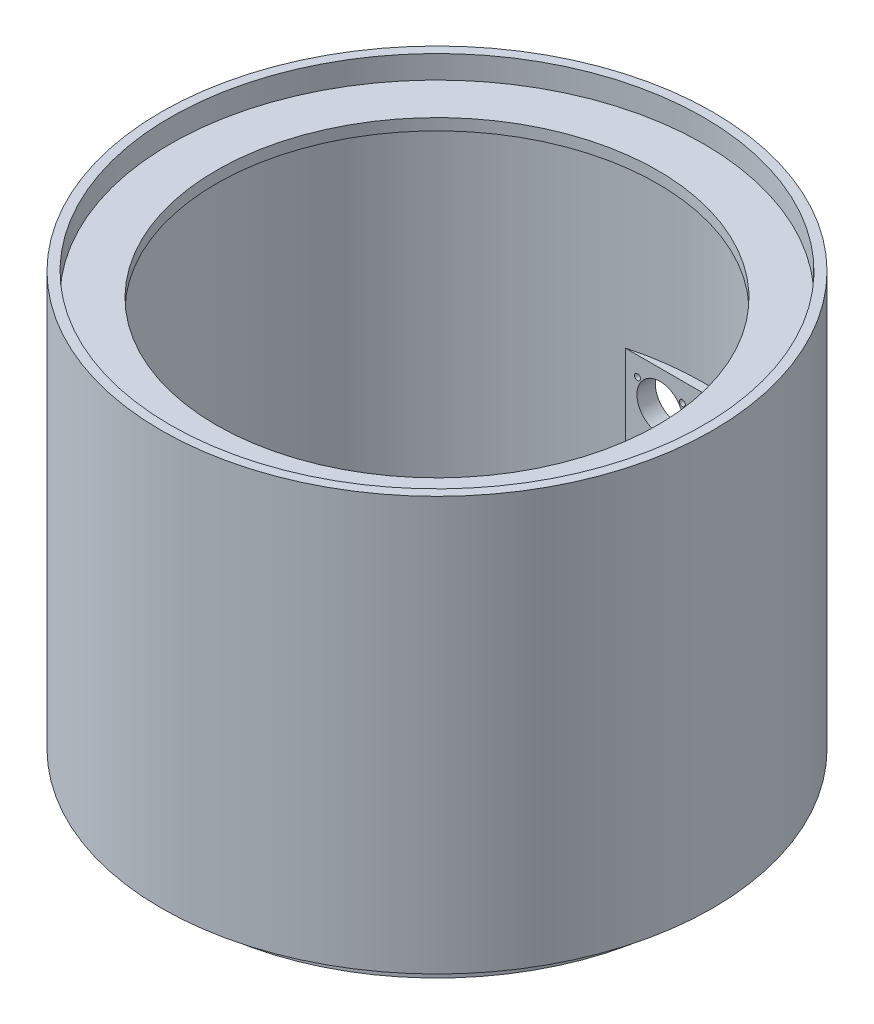
from build123d import *

# Parameters (mm, degrees)
CUT_EXTRUDE_1_REACH      = 256.755
SKETCH_2_R               = 2.5
PATTERN_CIRCULAR_1_COUNT = 12
SKETCH_3_W               = 60
SKETCH_3_H               = 45
EXTRUDE_1_DEPTH          = 8
CUT_EXTRUDE_2_REACH      = 330.786
SKETCH_4_R               = 10
SKETCH_4_R_2             = 1.3
CUT_EXTRUDE_3_REACH      = 330.786
SKETCH_5_R               = 1.3
SKETCH_5_W               = 12
SKETCH_5_H               = 22


with BuildPart() as part:
    # 草圖1 → 旋轉1 (revolve)
    with BuildSketch(Plane(origin=(0, 0, 0), x_dir=(0, 0, -1), z_dir=(1, 0, 0))):
        Polygon((0, 0), (108, 0), (108, 10), (120, 10), (120, 190), (116, 190), (116, 180), (96, 180), (96, 175), (116, 175), (116, 15), (104, 15), (104, 5), (0, 5), align=None)
    revolve(axis=Axis((0, 5, 0), (0, -1, 0)))

    # 草圖2 → 除料-伸長1 (cut, up to next)
    with BuildSketch(Plane.XZ, mode=Mode.PRIVATE) as cut_extrude_1_sk1:
        with Locations((0, -15)):
            Circle(SKETCH_2_R)
    cut_extrude_1_tool1 = extrude(cut_extrude_1_sk1.sketch, amount=-CUT_EXTRUDE_1_REACH, mode=Mode.PRIVATE) & part.part
    # 草圖2 → 除料-伸長1 (cut, up to next)
    with BuildSketch(Plane.XZ, mode=Mode.PRIVATE) as cut_extrude_1_sk2:
        with Locations((0, -25)):
            Circle(SKETCH_2_R)
    cut_extrude_1_tool2 = extrude(cut_extrude_1_sk2.sketch, amount=-CUT_EXTRUDE_1_REACH, mode=Mode.PRIVATE) & part.part
    # 草圖2 → 除料-伸長1 (cut, up to next)
    with BuildSketch(Plane.XZ, mode=Mode.PRIVATE) as cut_extrude_1_sk3:
        with Locations((0, -35)):
            Circle(SKETCH_2_R)
    cut_extrude_1_tool3 = extrude(cut_extrude_1_sk3.sketch, amount=-CUT_EXTRUDE_1_REACH, mode=Mode.PRIVATE) & part.part
    # 草圖2 → 除料-伸長1 (cut, up to next)
    with BuildSketch(Plane.XZ, mode=Mode.PRIVATE) as cut_extrude_1_sk4:
        with Locations((0, -45)):
            Circle(SKETCH_2_R)
    cut_extrude_1_tool4 = extrude(cut_extrude_1_sk4.sketch, amount=-CUT_EXTRUDE_1_REACH, mode=Mode.PRIVATE) & part.part
    # 草圖2 → 除料-伸長1 (cut, up to next)
    with BuildSketch(Plane.XZ, mode=Mode.PRIVATE) as cut_extrude_1_sk5:
        with Locations((0, -55)):
            Circle(SKETCH_2_R)
    cut_extrude_1_tool5 = extrude(cut_extrude_1_sk5.sketch, amount=-CUT_EXTRUDE_1_REACH, mode=Mode.PRIVATE) & part.part
    # 草圖2 → 除料-伸長1 (cut, up to next)
    with BuildSketch(Plane.XZ, mode=Mode.PRIVATE) as cut_extrude_1_sk6:
        with Locations((0, -65)):
            Circle(SKETCH_2_R)
    cut_extrude_1_tool6 = extrude(cut_extrude_1_sk6.sketch, amount=-CUT_EXTRUDE_1_REACH, mode=Mode.PRIVATE) & part.part
    # 草圖2 → 除料-伸長1 (cut, up to next)
    with BuildSketch(Plane.XZ, mode=Mode.PRIVATE) as cut_extrude_1_sk7:
        with Locations((0, -75)):
            Circle(SKETCH_2_R)
    cut_extrude_1_tool7 = extrude(cut_extrude_1_sk7.sketch, amount=-CUT_EXTRUDE_1_REACH, mode=Mode.PRIVATE) & part.part
    cut_extrude_1_1 = cut_extrude_1_tool1.solids().sort_by_distance((0, 0, -15))[0]
    add(cut_extrude_1_1, mode=Mode.SUBTRACT)
    cut_extrude_1_2 = cut_extrude_1_tool2.solids().sort_by_distance((0, 0, -25))[0]
    add(cut_extrude_1_2, mode=Mode.SUBTRACT)
    cut_extrude_1_3 = cut_extrude_1_tool3.solids().sort_by_distance((0, 0, -35))[0]
    add(cut_extrude_1_3, mode=Mode.SUBTRACT)
    cut_extrude_1_4 = cut_extrude_1_tool4.solids().sort_by_distance((0, 0, -45))[0]
    add(cut_extrude_1_4, mode=Mode.SUBTRACT)
    cut_extrude_1_5 = cut_extrude_1_tool5.solids().sort_by_distance((0, 0, -55))[0]
    add(cut_extrude_1_5, mode=Mode.SUBTRACT)
    cut_extrude_1_6 = cut_extrude_1_tool6.solids().sort_by_distance((0, 0, -65))[0]
    add(cut_extrude_1_6, mode=Mode.SUBTRACT)
    cut_extrude_1_7 = cut_extrude_1_tool7.solids().sort_by_distance((0, 0, -75))[0]
    add(cut_extrude_1_7, mode=Mode.SUBTRACT)
    cut_extrude_1 = cut_extrude_1_1 + cut_extrude_1_2 + cut_extrude_1_3 + cut_extrude_1_4 + cut_extrude_1_5 + cut_extrude_1_6 + cut_extrude_1_7  # 除料-伸長1 as one shape, for the pattern or mirror that repeats it

    # 環狀複製排列1: 除料-伸長1 ×12 about axis
    pattern_circular_1_axis = Axis((0, 15, 0), (0, 1, 0))
    for i in range(1, PATTERN_CIRCULAR_1_COUNT):
        add(cut_extrude_1.rotate(pattern_circular_1_axis, i * 360 / PATTERN_CIRCULAR_1_COUNT), mode=Mode.SUBTRACT)

    # 草圖3 → 填料-伸長1 (add)
    with BuildSketch(Plane(origin=(0, 0, -120), x_dir=(-1, 0, 0), z_dir=(0, 0, -1))):
        with Locations((0, 67.5)):
            Rectangle(SKETCH_3_W, SKETCH_3_H)
    extrude(amount=-EXTRUDE_1_DEPTH)

    # 草圖4 → 除料-伸長2 (cut, up to next)
    with BuildSketch(Plane(origin=(0, 0, -120), x_dir=(-1, 0, 0), z_dir=(0, 0, -1)), mode=Mode.PRIVATE) as cut_extrude_2_sk1:
        with Locations((15, 75)):
            Circle(SKETCH_4_R)
    cut_extrude_2_tool1 = extrude(cut_extrude_2_sk1.sketch, amount=-CUT_EXTRUDE_2_REACH, mode=Mode.PRIVATE) & part.part
    # 草圖4 → 除料-伸長2 (cut, up to next)
    with BuildSketch(Plane(origin=(0, 0, -120), x_dir=(-1, 0, 0), z_dir=(0, 0, -1)), mode=Mode.PRIVATE) as cut_extrude_2_sk2:
        with Locations((24.75, 81.7)):
            Circle(SKETCH_4_R_2)
    cut_extrude_2_tool2 = extrude(cut_extrude_2_sk2.sketch, amount=-CUT_EXTRUDE_2_REACH, mode=Mode.PRIVATE) & part.part
    # 草圖4 → 除料-伸長2 (cut, up to next)
    with BuildSketch(Plane(origin=(0, 0, -120), x_dir=(-1, 0, 0), z_dir=(0, 0, -1)), mode=Mode.PRIVATE) as cut_extrude_2_sk3:
        with Locations((5.25, 81.7)):
            Circle(SKETCH_4_R_2)
    cut_extrude_2_tool3 = extrude(cut_extrude_2_sk3.sketch, amount=-CUT_EXTRUDE_2_REACH, mode=Mode.PRIVATE) & part.part
    # 草圖4 → 除料-伸長2 (cut, up to next)
    with BuildSketch(Plane(origin=(0, 0, -120), x_dir=(-1, 0, 0), z_dir=(0, 0, -1)), mode=Mode.PRIVATE) as cut_extrude_2_sk4:
        with Locations((5.25, 47.7)):
            Circle(SKETCH_4_R_2)
    cut_extrude_2_tool4 = extrude(cut_extrude_2_sk4.sketch, amount=-CUT_EXTRUDE_2_REACH, mode=Mode.PRIVATE) & part.part
    # 草圖4 → 除料-伸長2 (cut, up to next)
    with BuildSketch(Plane(origin=(0, 0, -120), x_dir=(-1, 0, 0), z_dir=(0, 0, -1)), mode=Mode.PRIVATE) as cut_extrude_2_sk5:
        with Locations((24.75, 47.7)):
            Circle(SKETCH_4_R_2)
    cut_extrude_2_tool5 = extrude(cut_extrude_2_sk5.sketch, amount=-CUT_EXTRUDE_2_REACH, mode=Mode.PRIVATE) & part.part
    add(cut_extrude_2_tool1.solids().sort_by_distance((-15, 75, -120))[0], mode=Mode.SUBTRACT)
    add(cut_extrude_2_tool2.solids().sort_by_distance((-24.75, 81.7, -120))[0], mode=Mode.SUBTRACT)
    add(cut_extrude_2_tool3.solids().sort_by_distance((-5.25, 81.7, -120))[0], mode=Mode.SUBTRACT)
    add(cut_extrude_2_tool4.solids().sort_by_distance((-5.25, 47.7, -120))[0], mode=Mode.SUBTRACT)
    add(cut_extrude_2_tool5.solids().sort_by_distance((-24.75, 47.7, -120))[0], mode=Mode.SUBTRACT)

    # 草圖5 → 除料-伸長3 (cut, up to next)
    with BuildSketch(Plane(origin=(0, 0, -120), x_dir=(-1, 0, 0), z_dir=(0, 0, -1)), mode=Mode.PRIVATE) as cut_extrude_3_sk1:
        with Locations((-19, 87)):
            Circle(SKETCH_5_R)
    cut_extrude_3_tool1 = extrude(cut_extrude_3_sk1.sketch, amount=-CUT_EXTRUDE_3_REACH, mode=Mode.PRIVATE) & part.part
    # 草圖5 → 除料-伸長3 (cut, up to next)
    with BuildSketch(Plane(origin=(0, 0, -120), x_dir=(-1, 0, 0), z_dir=(0, 0, -1)), mode=Mode.PRIVATE) as cut_extrude_3_sk2:
        with Locations((-19, 60.5)):
            Circle(SKETCH_5_R)
    cut_extrude_3_tool2 = extrude(cut_extrude_3_sk2.sketch, amount=-CUT_EXTRUDE_3_REACH, mode=Mode.PRIVATE) & part.part
    # 草圖5 → 除料-伸長3 (cut, up to next)
    with BuildSketch(Plane(origin=(0, 0, -120), x_dir=(-1, 0, 0), z_dir=(0, 0, -1)), mode=Mode.PRIVATE) as cut_extrude_3_sk3:
        with Locations((-19, 74)):
            Rectangle(SKETCH_5_W, SKETCH_5_H)
    cut_extrude_3_tool3 = extrude(cut_extrude_3_sk3.sketch, amount=-CUT_EXTRUDE_3_REACH, mode=Mode.PRIVATE) & part.part
    add(cut_extrude_3_tool1.solids().sort_by_distance((19, 87, -120))[0], mode=Mode.SUBTRACT)
    add(cut_extrude_3_tool2.solids().sort_by_distance((19, 60.5, -120))[0], mode=Mode.SUBTRACT)
    add(cut_extrude_3_tool3.solids().sort_by_distance((19, 74, -120))[0], mode=Mode.SUBTRACT)


solid = part.part
